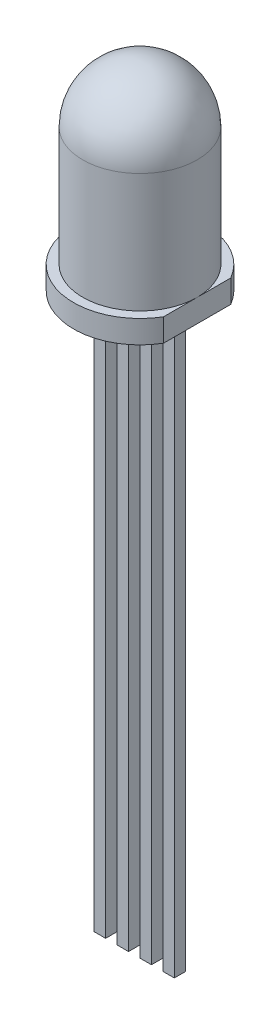
from build123d import *

# Parameters (mm, degrees)
CUT_EXTRUDE1_DEPTH      = 10.618211892
CUT_EXTRUDE1_DEPTH_BACK = 10.618211892
SKETCH3_W               = 0.5
SKETCH3_H               = 0.500000016
BOSS_EXTRUDE2_DEPTH     = 25


with BuildPart() as part:
    # Sketch1 → Revolve1 (revolve)
    with BuildSketch(Plane.XY, mode=Mode.PRIVATE) as revolve1_sk:
        with BuildLine():
            Line((0, 0), (2.9, 0))
            Line((2.9, 0), (2.9, 1))
            Line((2.9, 1), (2.5, 1))
            Line((2.5, 1), (2.5, 6.2))
            ThreePointArc((2.5, 6.2), (1.767766953, 7.967766953), (0, 8.7))
            Line((0, 8.7), (0, 0))
        make_face()
    revolve(revolve1_sk.sketch.rotate(Axis((0, 0, 0), (0, 1, 0)), 90), axis=Axis((0, 0, 0), (0, 1, 0)))

    # Sketch2 → Cut-Extrude1 (cut, two sides: drawn at the far end of the back side and taken through both)
    with BuildSketch(Plane(origin=(0, 0, 0), x_dir=(1, 0, 0), z_dir=(0, 1, 0)).offset(-CUT_EXTRUDE1_DEPTH_BACK)):
        Polygon((2.5, 0), (2.5, 2.5), (3.317010746, 2.5), (3.317010746, -2.186016692), (2.5, -2.186016692), align=None)
    extrude(amount=CUT_EXTRUDE1_DEPTH + CUT_EXTRUDE1_DEPTH_BACK, mode=Mode.SUBTRACT)

    # Sketch3 → Boss-Extrude2 (add)
    with BuildSketch(Plane.XZ):
        with Locations((-1.5, 0)):
            Rectangle(SKETCH3_W, SKETCH3_H)
        with Locations((-0.5, 0)):
            Rectangle(SKETCH3_W, SKETCH3_H)
        with Locations((0.5, 0)):
            Rectangle(SKETCH3_W, SKETCH3_H)
        with Locations((1.5, 0)):
            Rectangle(SKETCH3_W, SKETCH3_H)
    extrude(amount=BOSS_EXTRUDE2_DEPTH)


solid = part.part
